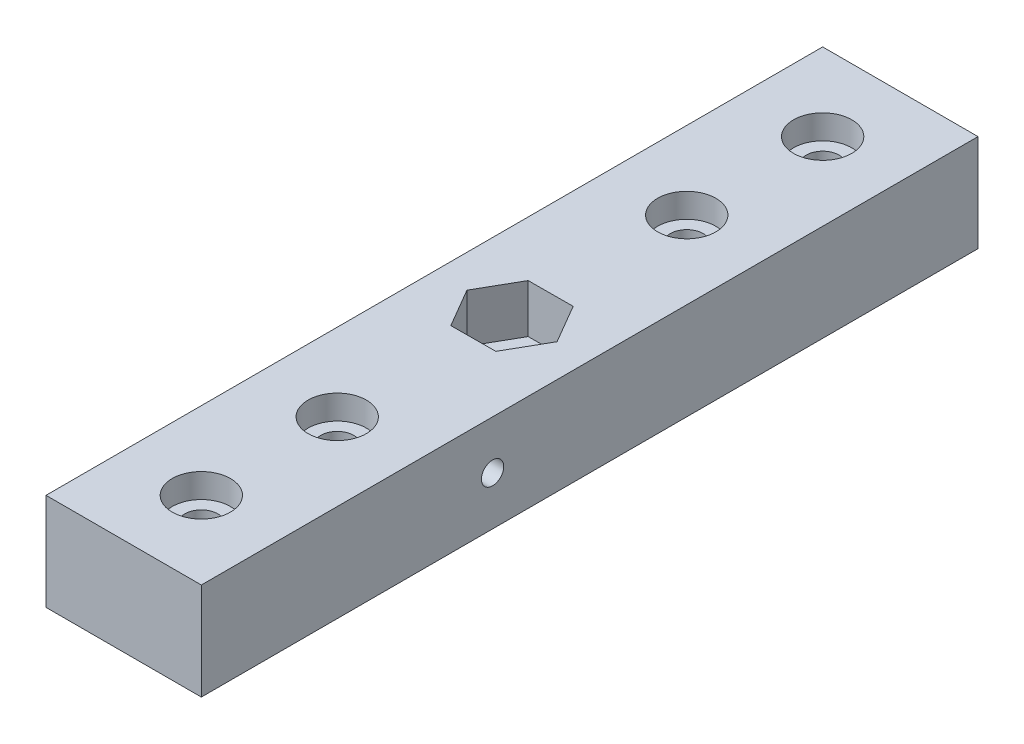
from build123d import *

# Parameters (mm, degrees)
SKETCH1_W           = 16
SKETCH1_H           = 80
BOSS_EXTRUDE1_DEPTH = 10
SKETCH2_R           = 2.35
CUT_EXTRUDE1_DEPTH  = 2.5
SKETCH2_3_R         = 1.7
CUT_EXTRUDE2_DEPTH  = 82.018516402
CUT_EXTRUDE3_START  = 7.5
SKETCH2_4_R         = 3
CUT_EXTRUDE3_DEPTH  = 74.518516402
SKETCH3_R           = 1.15
CUT_EXTRUDE4_DEPTH  = 83.194890352
CUT_EXTRUDE5_DEPTH  = 5
SKETCH6_R           = 2.5
CUT_EXTRUDE6_DEPTH  = 25


with BuildPart() as part:
    # Sketch1 → Boss-Extrude1 (new body)
    with BuildSketch(Plane(origin=(0, 0, 0), x_dir=(1, 0, 0), z_dir=(0, 1, 0))):
        with Locations((0, 40)):
            Rectangle(SKETCH1_W, SKETCH1_H)
    extrude(amount=BOSS_EXTRUDE1_DEPTH)

    # Sketch2 → Cut-Extrude1 (cut)
    with BuildSketch(Plane(origin=(0, 0, 0), x_dir=(1, 0, 0), z_dir=(0, 1, 0))):
        with Locations((0, 72)):
            Circle(SKETCH2_R)
        with Locations((0, 58)):
            Circle(SKETCH2_R)
        with Locations((0, 22)):
            Circle(SKETCH2_R)
        with Locations((0, 8)):
            Circle(SKETCH2_R)
    extrude(amount=CUT_EXTRUDE1_DEPTH, mode=Mode.SUBTRACT)

    # Sketch2<3> → Cut-Extrude2 (cut, through all)
    with BuildSketch(Plane(origin=(0, 0, 0), x_dir=(1, 0, 0), z_dir=(0, 1, 0))):
        with Locations((0, 72)):
            Circle(SKETCH2_3_R)
        with Locations((0, 58)):
            Circle(SKETCH2_3_R)
        with Locations((0, 22)):
            Circle(SKETCH2_3_R)
        with Locations((0, 8)):
            Circle(SKETCH2_3_R)
    extrude(amount=CUT_EXTRUDE2_DEPTH, mode=Mode.SUBTRACT)

    # Sketch2<4> → Cut-Extrude3 (cut, through all)
    with BuildSketch(Plane(origin=(0, 0, 0), x_dir=(1, 0, 0), z_dir=(0, 1, 0)).offset(CUT_EXTRUDE3_START)):
        with Locations((0, 72)):
            Circle(SKETCH2_4_R)
        with Locations((0, 58)):
            Circle(SKETCH2_4_R)
        with Locations((0, 22)):
            Circle(SKETCH2_4_R)
        with Locations((0, 8)):
            Circle(SKETCH2_4_R)
    extrude(amount=CUT_EXTRUDE3_DEPTH, mode=Mode.SUBTRACT)

    # Sketch3 → Cut-Extrude4 (cut, through all)
    with BuildSketch(Plane(origin=(8, 0, 0), x_dir=(0, 0, -1), z_dir=(1, 0, 0))):
        with Locations((30, 5)):
            Circle(SKETCH3_R)
    extrude(amount=-CUT_EXTRUDE4_DEPTH, mode=Mode.SUBTRACT)

    # Sketch4 → Cut-Extrude5 (cut)
    with BuildSketch(Plane.XZ.offset(-10)):
        Polygon((2.291567597, -44.010243295), (4.618756367, -40.020565894), (2.32718877, -36.010322599), (-2.291567597, -35.989756705), (-4.618756367, -39.979434106), (-2.32718877, -43.989677401), align=None)
    extrude(amount=CUT_EXTRUDE5_DEPTH, mode=Mode.SUBTRACT)

    # Sketch6 → Cut-Extrude6 (cut)
    with BuildSketch(Plane(origin=(0, 10, 0), x_dir=(-1, 0, 0), z_dir=(0, -1, 0))):
        with Locations((0, 40)):
            Circle(SKETCH6_R)
    extrude(amount=CUT_EXTRUDE6_DEPTH, mode=Mode.SUBTRACT)


solid = part.part
